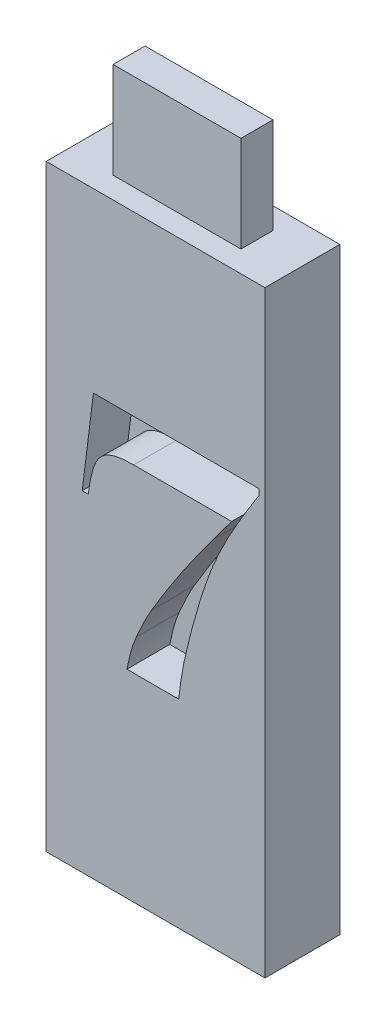
from build123d import *

# Parameters (mm, degrees)
SKETCH1_W           = 17.38
SKETCH1_H           = 47.498
BOSS_EXTRUDE1_DEPTH = 5.95
CUT_EXTRUDE1_DEPTH  = 3.41
SKETCH3_W           = 10.16
SKETCH3_H           = 2.54
BOSS_EXTRUDE2_DEPTH = 7.62


with BuildPart() as part:
    # Sketch1 → Boss-Extrude1 (new body)
    with BuildSketch(Plane.XY):
        Rectangle(SKETCH1_W, SKETCH1_H)
    extrude(amount=BOSS_EXTRUDE1_DEPTH)

    # Sketch2 → Cut-Extrude1 (cut)
    with BuildSketch(Plane.XY.offset(5.95)):
        with BuildLine():
            Line((8.21521828, 9.685626239), (8.21521828, 9.211700107))
            Line((8.21521828, 9.211700107), (7.849511502, 8.640749728))
            add(Edge.make_bspline(
                [(7.849511502, 8.640749728), (7.659628318, 8.334002218), (7.295032049, 7.745013788), (6.782872216, 6.88889346), (6.32474967, 6.098434688), (5.785332579, 5.145897577), (5.201924307, 4.005544018), (4.689678821, 2.864966249), (4.323103082, 1.941121665), (4.060487027, 1.215232336), (3.79297562, 0.453893084), (3.625200839, -0.069861436), (3.539395894, -0.337724864)],
                knots=[0, 0, 0, 0, 1.083039837, 2.079553741, 2.994830702, 3.825809671, 5.365663433, 6.838340046, 7.577558492, 8.349012095, 9.155636346, 10, 10, 10, 10], degree=3))
            add(Edge.make_bspline(
                [(3.539395894, -0.337724864), (3.294518486, -1.175139297), (2.807311479, -2.84125535), (2.421476965, -4.533716864), (2.229568553, -5.375522327)],
                knots=[0, 0, 0, 0, 1.005229416, 2, 2, 2, 2], degree=3))
            add(Edge.make_bspline(
                [(2.229568553, -5.375522327), (2.14861537, -5.818843498), (1.990394666, -6.685302183), (1.890335658, -7.560371208), (1.841471563, -7.987713605)],
                knots=[0, 0, 0, 0, 1.023294424, 2, 2, 2, 2], degree=3))
            Line((1.841471563, -7.987713605), (-2.278327252, -7.987713605))
            add(Edge.make_bspline(
                [(-2.278327252, -7.987713605), (-2.228426027, -7.742123959), (-2.132197133, -7.268531969), (-1.955335735, -6.592737484), (-1.766303583, -5.973619712), (-1.61053551, -5.589751553), (-1.535718589, -5.405375942)],
                knots=[0, 0, 0, 0, 1.116992291, 2.153993903, 3.113345314, 4, 4, 4, 4], degree=3))
            add(Edge.make_bspline(
                [(-1.535718589, -5.405375942), (-1.432470379, -5.170955855), (-1.233678754, -4.719609045), (-0.927100645, -4.077764225), (-0.630798746, -3.494030209), (-0.424952864, -3.130831897), (-0.326647197, -2.957379545)],
                knots=[0, 0, 0, 0, 1.125146569, 2.166330209, 3.124295659, 4, 4, 4, 4], degree=3))
            add(Edge.make_bspline(
                [(-0.326647197, -2.957379545), (-0.160956821, -2.676902535), (0.175753632, -2.106926516), (0.708141987, -1.248784349), (1.266217599, -0.367355885), (1.86140604, 0.532183687), (2.487318367, 1.452627488), (3.145855822, 2.393106788), (3.830525284, 3.357049593), (4.305847593, 4.000507598), (4.546955386, 4.326902418)],
                knots=[0, 0, 0, 0, 0.891601375, 1.811882565, 2.763935491, 3.74693406, 4.763958923, 5.810457796, 6.889352178, 8, 8, 8, 8], degree=3))
            Line((4.546955386, 4.326902418), (6.04709952, 6.342021403))
            Line((6.04709952, 6.342021403), (-1.737230487, 6.342021403))
            add(Edge.make_bspline(
                [(-1.737230487, 6.342021403), (-1.941407392, 6.33928709), (-2.324644322, 6.334154827), (-2.863158098, 6.274892972), (-3.328967641, 6.178379532), (-3.727025146, 6.035733564), (-4.070606045, 5.846274621), (-4.356427977, 5.588671706), (-4.60409946, 5.276798523), (-4.806692036, 4.896670937), (-4.974895269, 4.437516142), (-5.119721138, 3.888492313), (-5.250293202, 3.239224301), (-5.314926889, 2.771224888), (-5.349517854, 2.520758735)],
                knots=[0, 0, 0, 0, 1.211762192, 2.274459111, 3.211702032, 4.029445416, 4.776937485, 5.525195333, 6.297980953, 7.13082587, 8.070422764, 9.195545804, 10.499098859, 12, 12, 12, 12], degree=3))
            Line((-5.349517854, 2.520758735), (-5.827175687, 2.520758735))
            Line((-5.827175687, 2.520758735), (-4.935298951, 9.685626239))
            Line((-4.935298951, 9.685626239), (8.21521828, 9.685626239))
        make_face()
    extrude(amount=-CUT_EXTRUDE1_DEPTH, mode=Mode.SUBTRACT)

    # Sketch3 → Boss-Extrude2 (add)
    with BuildSketch(Plane(origin=(0, 23.749, 0), x_dir=(1, 0, 0), z_dir=(0, 1, 0))):
        with Locations((0, -2.975)):
            Rectangle(SKETCH3_W, SKETCH3_H)
    extrude(amount=BOSS_EXTRUDE2_DEPTH)


solid = part.part
